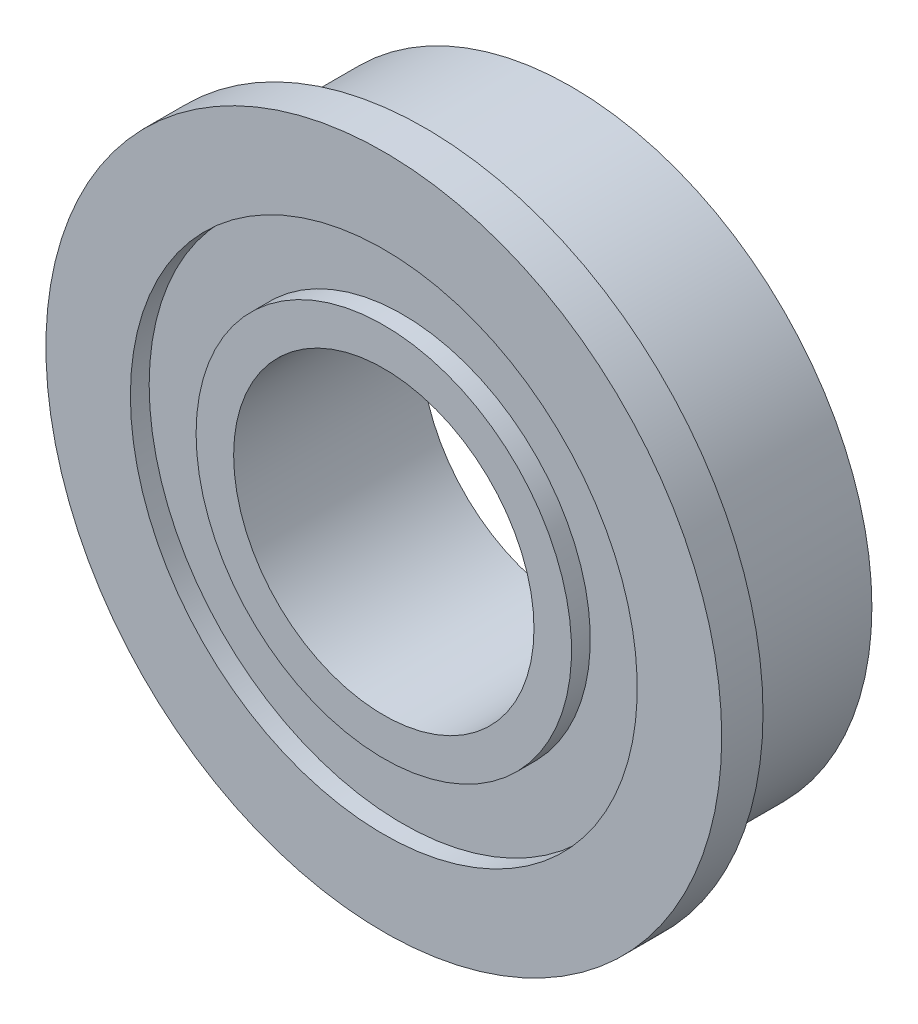
from build123d import *

# Parameters (mm, degrees)
SKETCH1_R           = 8
BOSS_EXTRUDE1_DEPTH = 3.9
SKETCH2_R           = 9
BOSS_EXTRUDE2_DEPTH = 1.1
SKETCH3_R           = 6.75
SKETCH3_R_2         = 5
CUT_EXTRUDE1_DEPTH  = 0.5
SKETCH3_3_R         = 4
CUT_EXTRUDE2_DEPTH  = 14.674794331


with BuildPart() as part:
    # Sketch1 → Boss-Extrude1 (new body)
    with BuildSketch(Plane.XY):
        Circle(SKETCH1_R)
    extrude(amount=BOSS_EXTRUDE1_DEPTH)

    # Sketch2 → Boss-Extrude2 (add)
    with BuildSketch(Plane.XY.offset(3.9)):
        Circle(SKETCH2_R)
    extrude(amount=BOSS_EXTRUDE2_DEPTH)

    # Sketch3 → Cut-Extrude1 (cut)
    with BuildSketch(Plane(origin=(0, 0, 0), x_dir=(-1, 0, 0), z_dir=(0, 0, -1))):
        Circle(SKETCH3_R)
        Circle(SKETCH3_R_2, mode=Mode.SUBTRACT)
    cut_extrude1 = extrude(amount=-CUT_EXTRUDE1_DEPTH, mode=Mode.SUBTRACT)

    # Sketch3<3> → Cut-Extrude2 (cut, through all)
    with BuildSketch(Plane(origin=(0, 0, 0), x_dir=(-1, 0, 0), z_dir=(0, 0, -1))):
        Circle(SKETCH3_3_R)
    extrude(amount=-CUT_EXTRUDE2_DEPTH, mode=Mode.SUBTRACT)

    # Mirror1: Cut-Extrude1 across plane
    add(cut_extrude1.mirror(Plane(origin=(0, 0, 2.5), x_dir=(1, 0, 0), z_dir=(0, 0, -1))), mode=Mode.SUBTRACT)


solid = part.part
